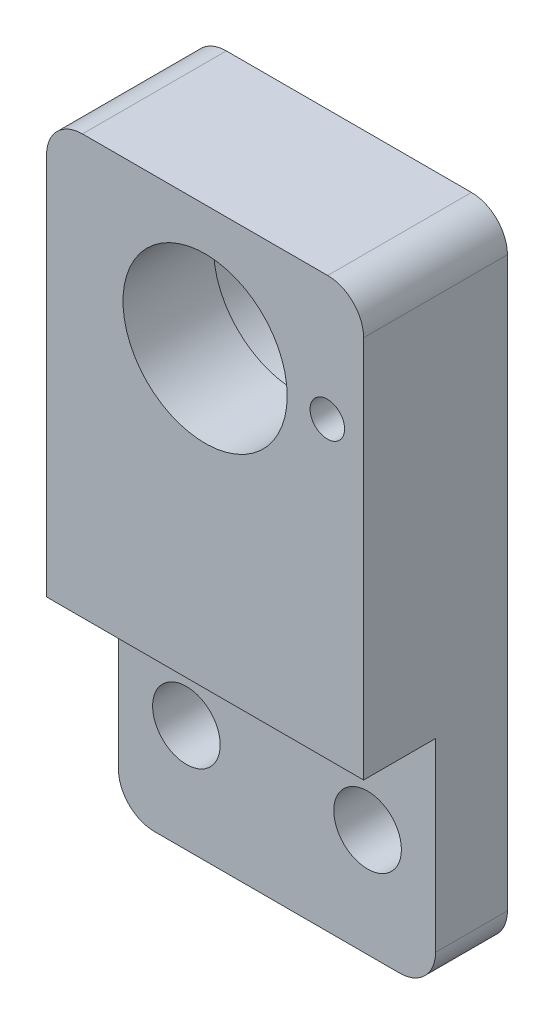
from build123d import *

# Parameters (mm, degrees)
SKETCH1_R           = 7.9502
SKETCH1_R_2         = 1.524
SKETCH1_R_3         = 2.9845
SKETCH1_R_4         = 7.250000001
BOSS_EXTRUDE1_DEPTH = 12.7
SKETCH1_3_R         = 7.9502
SKETCH1_3_R_2       = 7.250000001
CUT_EXTRUDE1_DEPTH  = 4.699
CUT_EXTRUDE2_START  = 6.35
SKETCH1_4_R         = 2.9845
CUT_EXTRUDE2_DEPTH  = 6.35


with BuildPart() as part:
    # Sketch1 → Boss-Extrude1 (new body)
    # profile 1 of 3: a face of its own
    with BuildSketch(Plane.XY):
        with BuildLine():
            Line((125.367960427, 117.540284058), (125.367960427, 83.715284058))
            Line((125.367960427, 83.715284058), (153.367960426, 83.715284058))
            Line((153.367960426, 83.715284058), (153.367960426, 117.540284058))
            ThreePointArc((153.367960426, 117.540284058), (152.438024457, 119.785348088), (150.192960426, 120.715284058))
            Line((150.192960426, 120.715284058), (128.542960427, 120.715284058))
            ThreePointArc((128.542960427, 120.715284058), (126.297896397, 119.785348088), (125.367960427, 117.540284058))
        make_face()
        with Locations((139.367960428, 109.715284059)):
            Circle(SKETCH1_R, mode=Mode.SUBTRACT)
        with Locations((150.162960428, 109.715284059)):
            Circle(SKETCH1_R_2, mode=Mode.SUBTRACT)
    # profile 2 of 3: a face of its own
    with BuildSketch(Plane.XY):
        with BuildLine():
            ThreePointArc((125.367960427, 67.360204058), (126.297896397, 65.115140027), (128.542960427, 64.185204058))
            Line((128.542960427, 64.185204058), (150.192960426, 64.185204058))
            ThreePointArc((150.192960426, 64.185204058), (152.438024457, 65.115140027), (153.367960426, 67.360204058))
            Line((153.367960426, 67.360204058), (153.367960426, 83.715284058))
            Line((153.367960426, 83.715284058), (125.367960427, 83.715284058))
            Line((125.367960427, 83.715284058), (125.367960427, 67.360204058))
        make_face()
        with Locations((131.367960426, 73.715284058)):
            Circle(SKETCH1_R_3, mode=Mode.SUBTRACT)
        with Locations((147.367960427, 73.715284058)):
            Circle(SKETCH1_R_3, mode=Mode.SUBTRACT)
    # profile 3 of 3: a face of its own
    with BuildSketch(Plane.XY):
        with Locations((139.367960428, 109.715284059)):
            Circle(SKETCH1_R)
        with Locations((139.367960428, 109.715284059)):
            Circle(SKETCH1_R_4, mode=Mode.SUBTRACT)
    extrude(amount=BOSS_EXTRUDE1_DEPTH)

    # Sketch1<3> → Cut-Extrude1 (cut)
    with BuildSketch(Plane.XY):
        with Locations((139.367960428, 109.715284059)):
            Circle(SKETCH1_3_R)
        with Locations((139.367960428, 109.715284059)):
            Circle(SKETCH1_3_R_2, mode=Mode.SUBTRACT)
    extrude(amount=CUT_EXTRUDE1_DEPTH, mode=Mode.SUBTRACT)

    # Sketch1<4> → Cut-Extrude2 (cut)
    with BuildSketch(Plane.XY.offset(CUT_EXTRUDE2_START)):
        with BuildLine():
            ThreePointArc((125.367960427, 67.360204058), (126.297896397, 65.115140027), (128.542960427, 64.185204058))
            Line((128.542960427, 64.185204058), (150.192960426, 64.185204058))
            ThreePointArc((150.192960426, 64.185204058), (152.438024457, 65.115140027), (153.367960426, 67.360204058))
            Line((153.367960426, 67.360204058), (153.367960426, 83.715284058))
            Line((153.367960426, 83.715284058), (125.367960427, 83.715284058))
            Line((125.367960427, 83.715284058), (125.367960427, 67.360204058))
        make_face()
        with Locations((131.367960426, 73.715284058)):
            Circle(SKETCH1_4_R, mode=Mode.SUBTRACT)
        with Locations((147.367960427, 73.715284058)):
            Circle(SKETCH1_4_R, mode=Mode.SUBTRACT)
    extrude(amount=CUT_EXTRUDE2_DEPTH, mode=Mode.SUBTRACT)


solid = part.part
